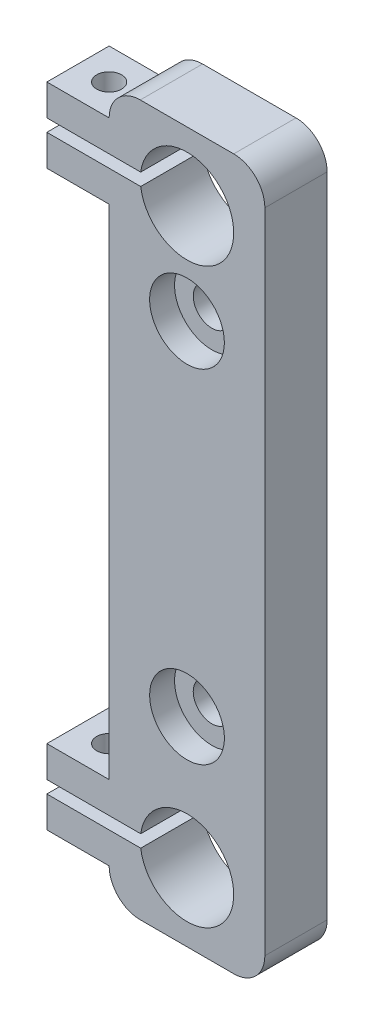
from build123d import *

# Parameters (mm, degrees)
EXTRUDE_1_DEPTH          = 10
SKETCH_4_R               = 3
CUT_EXTRUDE_1_DEPTH      = 60.205151803
SKETCH_2_R               = 7.5
CUT_EXTRUDE_3_DEPTH      = 60.205151803
SKETCH_6_R               = 6
CUT_EXTRUDE_4_DEPTH      = 4
SKETCH_7_W               = 10
SKETCH_7_H               = 5
EXTRUDE_2_DEPTH          = 10
SKETCH_8_W               = 20
SKETCH_8_H               = 2
CUT_EXTRUDE_6_DEPTH      = 63.090659523
CUT_EXTRUDE_7_DEPTH      = 63.090659523
CUT_EXTRUDE_7_DEPTH_BACK = 63.090659523
SKETCH_10_R              = 2


with BuildPart() as part:
    # 草图1 → 凸台-拉伸1 (new body)
    with BuildSketch(Plane.XY):
        with BuildLine():
            Line((-7.5, -57), (7.5, -57))
            ThreePointArc((7.5, -57), (11.035533906, -55.535533906), (12.5, -52))
            Line((12.5, -52), (12.5, 52))
            ThreePointArc((12.5, 52), (11.035533906, 55.535533906), (7.5, 57))
            Line((7.5, 57), (-7.5, 57))
            ThreePointArc((-7.5, 57), (-11.035533906, 55.535533906), (-12.5, 52))
            Line((-12.5, 52), (-12.5, -52))
            ThreePointArc((-12.5, -52), (-11.035533906, -55.535533906), (-7.5, -57))
        make_face()
    extrude(amount=EXTRUDE_1_DEPTH)

    # 草图4 → 切除-拉伸1 (cut, through all)
    with BuildSketch(Plane.XY.offset(10)):
        with Locations((0, 30)):
            Circle(SKETCH_4_R)
        with Locations(Location((0, -25, 0), (0, 0, 180))):
            Circle(SKETCH_4_R)
    extrude(amount=-CUT_EXTRUDE_1_DEPTH, mode=Mode.SUBTRACT)

    # 草图2 → 切除-拉伸3 (cut, through all)
    with BuildSketch(Plane.XY.offset(10)):
        with Locations((0, 46)):
            Circle(SKETCH_2_R)
        with Locations(Location((0, -46, 0), (0, 0, 180))):
            Circle(SKETCH_2_R)
    extrude(amount=-CUT_EXTRUDE_3_DEPTH, mode=Mode.SUBTRACT)

    # 草图6 → 切除-拉伸4 (cut)
    with BuildSketch(Plane.XY.offset(10)):
        with Locations((0, 30)):
            Circle(SKETCH_6_R)
        with Locations(Location((0, -25, 0), (0, 0, 180))):
            Circle(SKETCH_6_R)
    extrude(amount=-CUT_EXTRUDE_4_DEPTH, mode=Mode.SUBTRACT)

    # 草图7 → 凸台-拉伸2 (add)
    with BuildSketch(Plane.XY):
        with Locations((-17.5, 49.5)):
            Rectangle(SKETCH_7_W, SKETCH_7_H)
        with Locations((-17.5, 42.5)):
            Rectangle(SKETCH_7_W, SKETCH_7_H)
        with Locations((-17.5, -42.5)):
            Rectangle(SKETCH_7_W, SKETCH_7_H)
        with Locations((-17.5, -49.5)):
            Rectangle(SKETCH_7_W, SKETCH_7_H)
    extrude(amount=EXTRUDE_2_DEPTH)

    # 草图8 → 切除-拉伸6 (cut, through all)
    with BuildSketch(Plane.XY):
        with Locations((-12.5, 46)):
            Rectangle(SKETCH_8_W, SKETCH_8_H)
        with Locations((-12.5, -46)):
            Rectangle(SKETCH_8_W, SKETCH_8_H)
    extrude(amount=CUT_EXTRUDE_6_DEPTH, mode=Mode.SUBTRACT)

    # 草图10 → 切除-拉伸7 (cut, two sides: drawn at the far end of the back side and taken through both)
    with BuildSketch(Plane(origin=(0, 0, 0), x_dir=(1, 0, 0), z_dir=(0, 1, 0)).offset(-CUT_EXTRUDE_7_DEPTH_BACK)):
        with Locations(Location((-17.5, -5, 0), (0, 0, 270))):
            Circle(SKETCH_10_R)
    extrude(amount=CUT_EXTRUDE_7_DEPTH + CUT_EXTRUDE_7_DEPTH_BACK, mode=Mode.SUBTRACT)


solid = part.part
